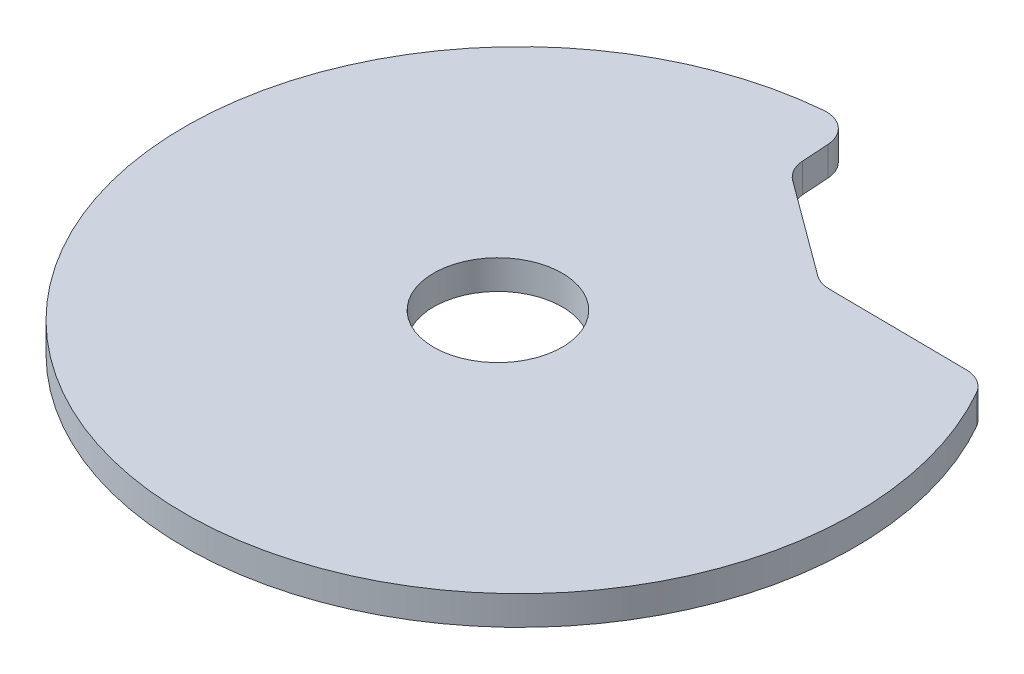
from build123d import *

# Parameters (mm, degrees)
EXTRUDE_1_DEPTH     = 5
SKETCH_3_R          = 11
CUT_EXTRUDE_1_DEPTH = 158.534808963


with BuildPart() as part:
    # Эскиз1 → Вытянуть1 (new body)
    with BuildSketch(Plane(origin=(0, 0, 0), x_dir=(1, 0, 0), z_dir=(0, 1, 0))):
        with BuildLine():
            Line((110.693591381, -10.706034223), (86.987107148, -10.47450238))
            ThreePointArc((86.987107148, -10.47450238), (85.452697722, -10.217456373), (84.071576651, -9.501223505))
            Line((84.071576651, -9.501223505), (67.773001994, 2.498048819))
            ThreePointArc((67.773001994, 2.498048819), (66.350950932, 4.124659089), (65.74794659, 6.199382193))
            Line((65.74794659, 6.199382193), (65.441843699, 10.89653157))
            ThreePointArc((65.441843699, 10.89653157), (63.704749785, 14.369065402), (60.006376962, 15.55144645))
            ThreePointArc((60.006376962, 15.55144645), (38.518658839, -92.399615134), (114.99158645, -13.234944542))
            ThreePointArc((114.99158645, -13.234944542), (113.18036629, -11.396421777), (110.693591381, -10.706034223))
        make_face()
    extrude(amount=EXTRUDE_1_DEPTH)

    # Эскиз3 → Вырез-Вытянуть1 (cut, through all)
    with BuildSketch(Plane(origin=(0, 5, 0), x_dir=(1, 0, 0), z_dir=(0, 1, 0))):
        with Locations(Location((61.772466567, -41.971863474, 0), (0, 0, 270))):
            Circle(SKETCH_3_R)
    extrude(amount=-CUT_EXTRUDE_1_DEPTH, mode=Mode.SUBTRACT)


solid = part.part
